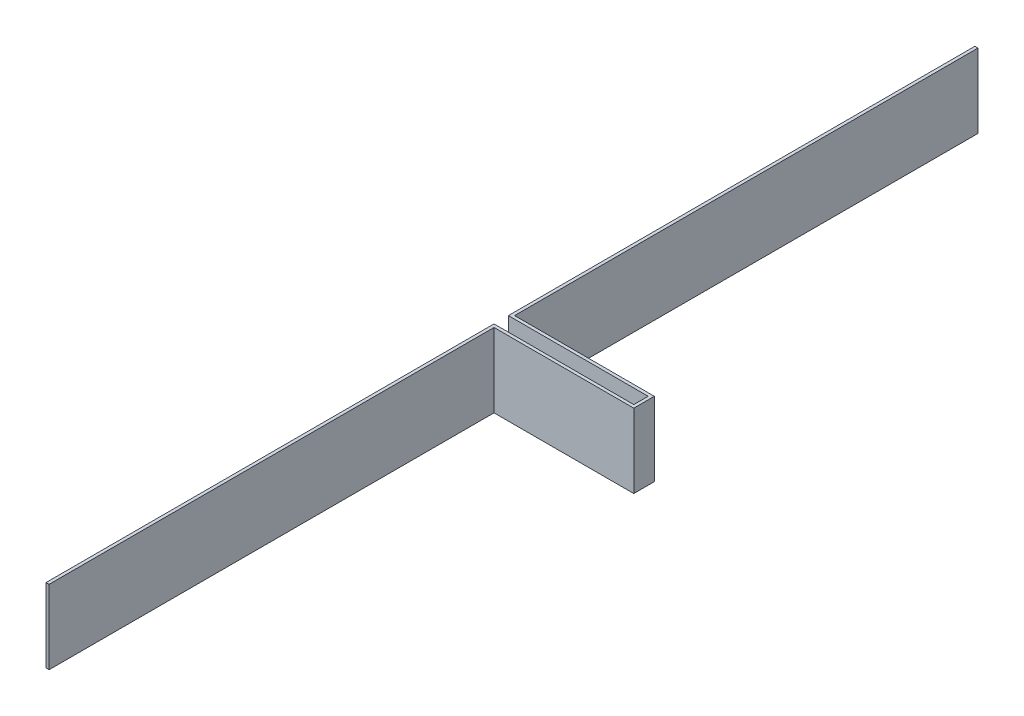
from build123d import *

# Parameters (mm, degrees)
BOSS_EXTRUDE1_DEPTH = 457.2


with BuildPart() as part:
    # Sketch1 → Boss-Extrude1 (new body)
    with BuildSketch(Plane(origin=(0, 0, 0), x_dir=(1, 0, 0), z_dir=(0, 1, 0))):
        Polygon((0, 0), (0, 2768.6), (863.6, 2768.6), (863.6, 2857.5), (0, 2857.5), (0, 5740.4), (19.05, 5740.4), (19.05, 2876.55), (882.65, 2876.55), (882.65, 2749.55), (19.05, 2749.55), (19.05, 0), align=None)
    extrude(amount=BOSS_EXTRUDE1_DEPTH)


solid = part.part
